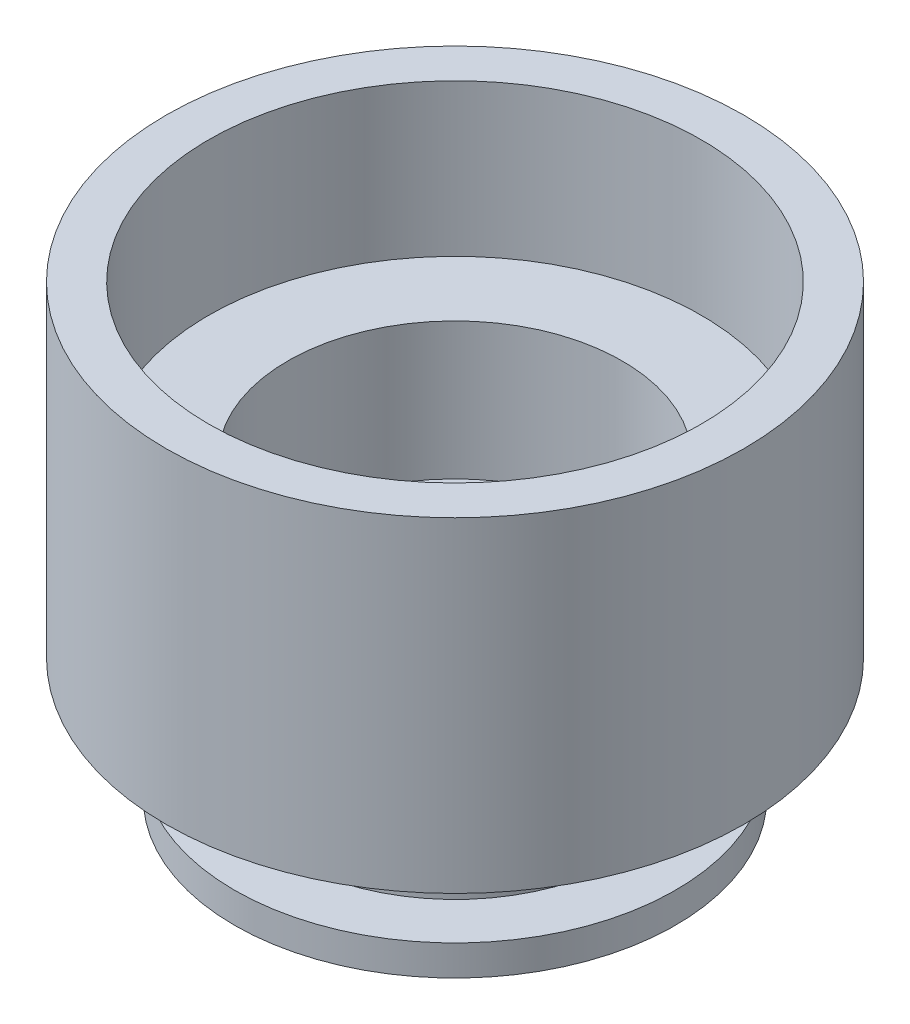
from build123d import *

# Parameters (mm, degrees)
SKETCH1_R           = 7.25
BOSS_EXTRUDE1_DEPTH = 1
SKETCH2_R           = 5.5
BOSS_EXTRUDE2_DEPTH = 3
SKETCH3_R           = 9.5
BOSS_EXTRUDE3_DEPTH = 1.2
SKETCH4_R           = 9.5
SKETCH4_R_2         = 5.5
BOSS_EXTRUDE4_DEPTH = 4.5
SKETCH5_R           = 9.5
SKETCH5_R_2         = 8.1
BOSS_EXTRUDE5_DEPTH = 5


with BuildPart() as part:
    # Sketch1 → Boss-Extrude1 (new body)
    with BuildSketch(Plane(origin=(0, 0, 0), x_dir=(1, 0, 0), z_dir=(0, 1, 0))):
        with Locations(Location((0, 0, 0), (0, 0, 270))):
            Circle(SKETCH1_R)
    extrude(amount=BOSS_EXTRUDE1_DEPTH)

    # Sketch2 → Boss-Extrude2 (add)
    with BuildSketch(Plane(origin=(0, 1, 0), x_dir=(1, 0, 0), z_dir=(0, 1, 0))):
        with Locations(Location((0, 0, 0), (0, 0, 270))):
            Circle(SKETCH2_R)
    extrude(amount=BOSS_EXTRUDE2_DEPTH)

    # Sketch3 → Boss-Extrude3 (add)
    with BuildSketch(Plane(origin=(0, 4, 0), x_dir=(1, 0, 0), z_dir=(0, 1, 0))):
        with Locations(Location((0, 0, 0), (0, 0, 270))):
            Circle(SKETCH3_R)
    extrude(amount=BOSS_EXTRUDE3_DEPTH)

    # Sketch4 → Boss-Extrude4 (add)
    with BuildSketch(Plane(origin=(0, 5.2, 0), x_dir=(1, 0, 0), z_dir=(0, 1, 0))):
        with Locations(Location((0, 0, 0), (0, 0, 270))):
            Circle(SKETCH4_R)
        with Locations(Location((0, 0, 0), (0, 0, 270))):
            Circle(SKETCH4_R_2, mode=Mode.SUBTRACT)
    extrude(amount=BOSS_EXTRUDE4_DEPTH)

    # Sketch5 → Boss-Extrude5 (add)
    with BuildSketch(Plane(origin=(0, 9.7, 0), x_dir=(1, 0, 0), z_dir=(0, 1, 0))):
        with Locations(Location((0, 0, 0), (0, 0, 270))):
            Circle(SKETCH5_R)
        with Locations(Location((0, 0, 0), (0, 0, 270))):
            Circle(SKETCH5_R_2, mode=Mode.SUBTRACT)
    extrude(amount=BOSS_EXTRUDE5_DEPTH)


solid = part.part
